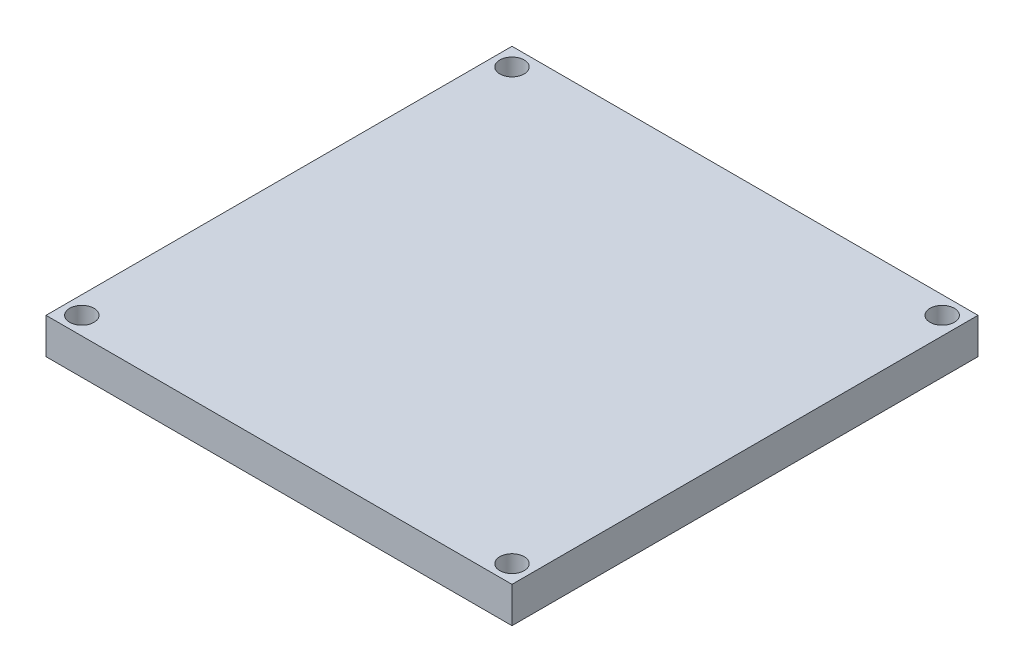
from build123d import *

# Parameters (mm, degrees)
SKETCH1_W   = 65
SKETCH1_H   = 65
SKETCH1_R   = 1.7
PLATE_DEPTH = 5


with BuildPart() as part:
    # Sketch1 → Plate (new body)
    with BuildSketch(Plane(origin=(0, 0, 0), x_dir=(1, 0, 0), z_dir=(0, 1, 0))):
        with Locations((32.5, 32.5)):
            Rectangle(SKETCH1_W, SKETCH1_H)
        with Locations(Location((62.5, 62.5, 0), (0, 0, 270))):
            Circle(SKETCH1_R, mode=Mode.SUBTRACT)
        with Locations(Location((2.5, 62.5, 0), (0, 0, 90))):
            Circle(SKETCH1_R, mode=Mode.SUBTRACT)
        with Locations(Location((62.5, 2.5, 0), (0, 0, 90))):
            Circle(SKETCH1_R, mode=Mode.SUBTRACT)
        with Locations(Location((2.5, 2.5, 0), (0, 0, 270))):
            Circle(SKETCH1_R, mode=Mode.SUBTRACT)
    extrude(amount=PLATE_DEPTH)


solid = part.part
